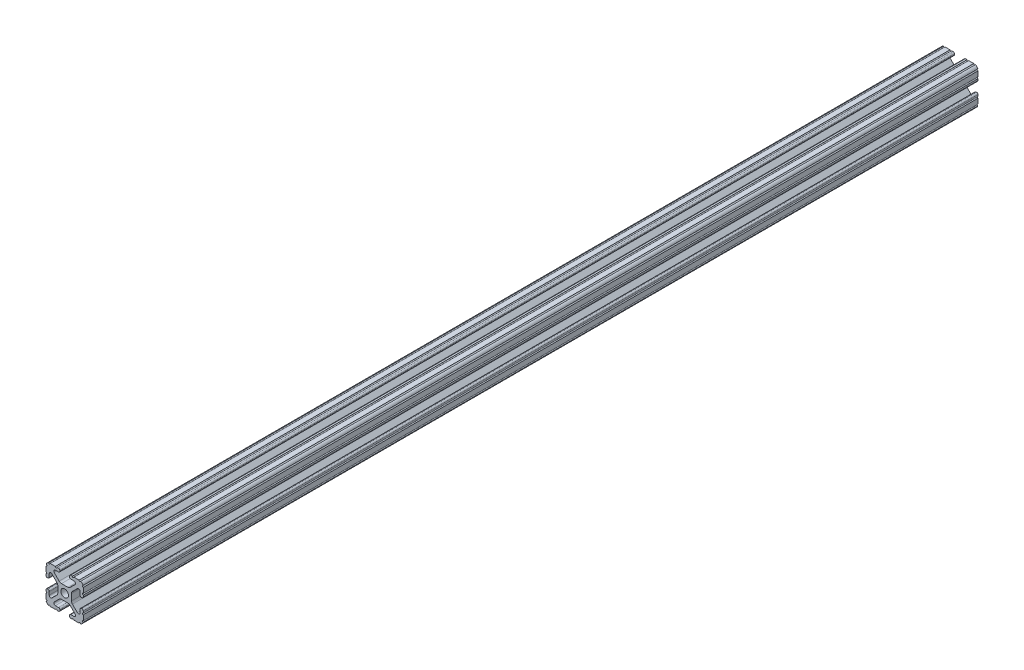
from build123d import *

# Parameters (mm, degrees)
BOSS_EXTRUDE1_DEPTH     = 304.8
CUT_EXTRUDE1_DEPTH      = 306.328708116
CUT_EXTRUDE1_DEPTH_BACK = 306.328708116
SKETCH5_R               = 0.55245


with BuildPart() as part:
    # Sketch4 → Boss-Extrude1 (new, symmetric)
    with BuildSketch(Plane.XY):
        with BuildLine():
            Line((4.190365, -12.7), (10.11729625, -12.7))
            ThreePointArc((10.11729625, -12.7), (11.943543585, -11.943543585), (12.7, -10.11729625))
            Line((12.7, -10.11729625), (12.7, -4.190365))
            ThreePointArc((12.7, -4.190365), (12.42492494, -3.52627506), (11.760835, -3.2512))
            Line((11.760835, -3.2512), (11.429365, -3.2512))
            ThreePointArc((11.429365, -3.2512), (10.76527506, -3.52627506), (10.4902, -4.190365))
            Line((10.4902, -4.190365), (10.4902, -6.348478019))
            ThreePointArc((10.4902, -6.348478019), (9.830707141, -7.335478831), (8.666460301, -7.103895736))
            Line((8.666460301, -7.103895736), (5.299899128, -3.737334563))
            ThreePointArc((5.299899128, -3.737334563), (4.817571085, -3.015479634), (4.6482, -2.16399369))
            Line((4.6482, -2.16399369), (4.6482, 0))
            Line((4.6482, 0), (2.6035, 0))
            ThreePointArc((2.6035, 0), (1.840952505, -1.840952505), (0, -2.6035))
            Line((0, -2.6035), (0, -4.6482))
            Line((0, -4.6482), (2.16399369, -4.6482))
            ThreePointArc((2.16399369, -4.6482), (3.015479634, -4.817571085), (3.737334563, -5.299899128))
            Line((3.737334563, -5.299899128), (7.103895736, -8.666460301))
            ThreePointArc((7.103895736, -8.666460301), (7.335478831, -9.830707141), (6.348478019, -10.4902))
            Line((6.348478019, -10.4902), (4.190365, -10.4902))
            ThreePointArc((4.190365, -10.4902), (3.52627506, -10.76527506), (3.2512, -11.429365))
            Line((3.2512, -11.429365), (3.2512, -11.760835))
            ThreePointArc((3.2512, -11.760835), (3.52627506, -12.42492494), (4.190365, -12.7))
        make_face()
    extrude(amount=BOSS_EXTRUDE1_DEPTH, both=True)

    # Sketch5 → Cut-Extrude1 (cut, two sides: drawn at the far end of the back side and taken through both)
    with BuildSketch(Plane.XY.offset(-CUT_EXTRUDE1_DEPTH_BACK)):
        with Locations((10.356153152, -12.7)):
            Circle(SKETCH5_R)
        with Locations((5.796028019, -12.7)):
            Circle(SKETCH5_R)
        with Locations((12.7, -10.356153152)):
            Circle(SKETCH5_R)
        with Locations((12.7, -5.796028019)):
            Circle(SKETCH5_R)
    extrude(amount=CUT_EXTRUDE1_DEPTH + CUT_EXTRUDE1_DEPTH_BACK, mode=Mode.SUBTRACT)

    # Mirror1: part across plane


with BuildPart() as part_1:
    add(part.part)
    add(part.part.mirror(Plane(origin=(0, 0, 0), x_dir=(0, 0, 1), z_dir=(1, 0, 0))))

    # Mirror2: part across plane


with BuildPart() as part_2:
    add(part_1.part)
    add(part_1.part.mirror(Plane.ZX))


solid = part_2.part
